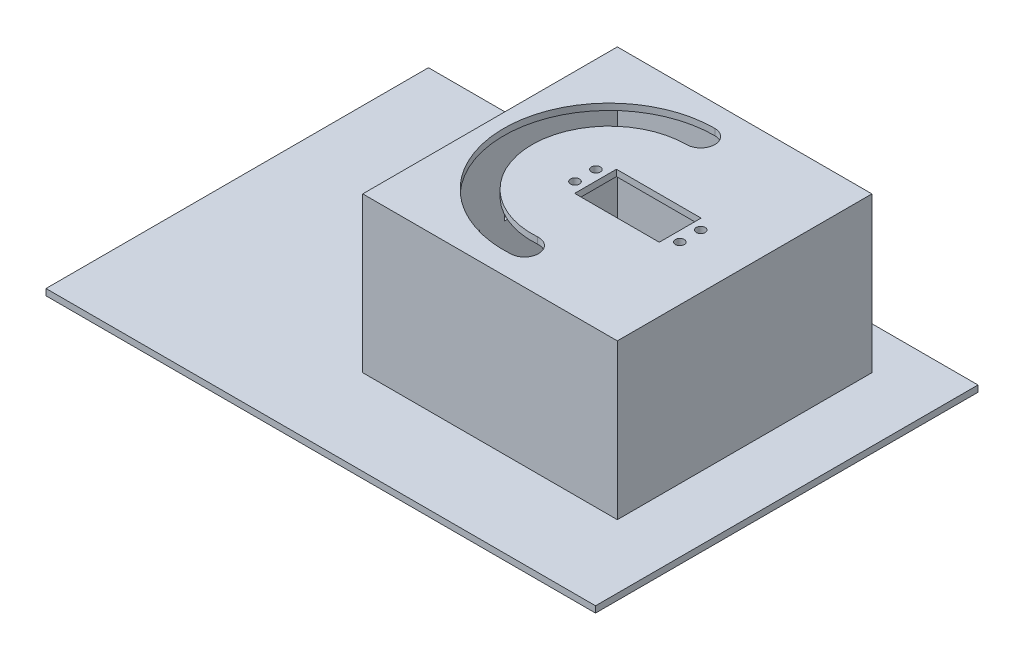
from build123d import *

# Parameters (mm, degrees)
SKETCH1_W           = 140
SKETCH1_H           = 160
BOSS_EXTRUDE1_DEPTH = 3
SKETCH2_W           = 120
SKETCH2_H           = 120
SKETCH2_W_2         = 117
SKETCH2_H_2         = 117
BOSS_EXTRUDE2_DEPTH = 70
SKETCH4_W           = 120
SKETCH4_H           = 120
BOSS_EXTRUDE4_DEPTH = 3
SKETCH5_R           = 2.1
SKETCH5_W           = 39.9
SKETCH5_H           = 19.71
CUT_EXTRUDE2_DEPTH  = 3
SKETCH6_W           = 18.298163042
SKETCH6_H           = 17.309993256
CUT_EXTRUDE3_DEPTH  = 3
CUT_EXTRUDE8_DEPTH  = 5
SKETCH15_W          = 259.021634325
SKETCH15_H          = 180.269434884
BOSS_EXTRUDE5_DEPTH = 3
SKETCH18_R          = 1.6
CUT_EXTRUDE9_DEPTH  = 10
SKETCH19_W          = 12
SKETCH19_H          = 4.5
SKETCH19_H_2        = 8.4
SKETCH19_W_2        = 10.084057066
SKETCH19_H_3        = 7.362028533
CUT_EXTRUDE11_DEPTH = 5


with BuildPart() as part:
    # Sketch1 → Boss-Extrude1 (new body)
    with BuildSketch(Plane(origin=(0, 0, 0), x_dir=(1, 0, 0), z_dir=(0, 1, 0))):
        Rectangle(SKETCH1_W, SKETCH1_H)
    extrude(amount=BOSS_EXTRUDE1_DEPTH)

    # Sketch2 → Boss-Extrude2 (add)
    with BuildSketch(Plane(origin=(0, 3, 0), x_dir=(1, 0, 0), z_dir=(0, 1, 0))):
        Rectangle(SKETCH2_W, SKETCH2_H)
        Rectangle(SKETCH2_W_2, SKETCH2_H_2, mode=Mode.SUBTRACT)
    extrude(amount=BOSS_EXTRUDE2_DEPTH)

    # Sketch4 → Boss-Extrude4 (add)
    with BuildSketch(Plane(origin=(0, 73, 0), x_dir=(1, 0, 0), z_dir=(0, 1, 0))):
        Rectangle(SKETCH4_W, SKETCH4_H)
    extrude(amount=BOSS_EXTRUDE4_DEPTH)

    # Sketch5 → Cut-Extrude2 (cut)
    with BuildSketch(Plane(origin=(0, 76, 0), x_dir=(1, 0, 0), z_dir=(0, 1, 0))):
        with Locations(Location((34.39, -4.925, 0), (0, 0, 270))):
            Circle(SKETCH5_R)
        with Locations(Location((34.39, 4.925, 0), (0, 0, 270))):
            Circle(SKETCH5_R)
        with Locations(Location((-15.03, -4.925, 0), (0, 0, 270))):
            Circle(SKETCH5_R)
        with Locations(Location((-15.03, 4.925, 0), (0, 0, 270))):
            Circle(SKETCH5_R)
        with Locations((9.68, 0)):
            Rectangle(SKETCH5_W, SKETCH5_H)
    extrude(amount=-CUT_EXTRUDE2_DEPTH, mode=Mode.SUBTRACT)

    # Sketch6 → Cut-Extrude3 (cut)
    with BuildSketch(Plane(origin=(0, 76, 0), x_dir=(1, 0, 0), z_dir=(0, 1, 0))):
        Rectangle(SKETCH6_W, SKETCH6_H)
    extrude(amount=-CUT_EXTRUDE3_DEPTH, mode=Mode.SUBTRACT)

    # Sketch13 → Cut-Extrude8 (cut)
    with BuildSketch(Plane(origin=(0, 76, 0), x_dir=(1, 0, 0), z_dir=(0, 1, 0))):
        with BuildLine():
            ThreePointArc((-3.792582359, 49.728765052), (-53.491503795, -1.722579942), (-0.349490011, -49.609426409))
            ThreePointArc((-0.349490011, -49.609426409), (5.82592347, -42.51288634), (-1.270616599, -36.337472859))
            ThreePointArc((-1.270616599, -36.337472859), (-40.195607742, -1.261740085), (-3.792582359, 36.42488497))
            ThreePointArc((-3.792582359, 36.42488497), (2.859357682, 43.076825011), (-3.792582359, 49.728765052))
        make_face()
    extrude(amount=-CUT_EXTRUDE8_DEPTH, mode=Mode.SUBTRACT)

    # Sketch15 → Boss-Extrude5 (add)
    with BuildSketch(Plane(origin=(0, 3, 0), x_dir=(1, 0, 0), z_dir=(0, 1, 0))):
        with Locations((-39.510817163, -10.134717442)):
            Rectangle(SKETCH15_W, SKETCH15_H)
    extrude(amount=-BOSS_EXTRUDE5_DEPTH)

    # Sketch18 → Cut-Extrude9 (cut)
    with BuildSketch(Plane(origin=(0, 3, 0), x_dir=(1, 0, 0), z_dir=(0, 1, 0))):
        with Locations(Location((-55.452, -27.227420358, 0), (0, 0, 270))):
            Circle(SKETCH18_R)
        with Locations(Location((-55.452, 32.208579642, 0), (0, 0, 270))):
            Circle(SKETCH18_R)
        with Locations(Location((4.746, 32.208579642, 0), (0, 0, 270))):
            Circle(SKETCH18_R)
        with Locations(Location((4.746, -27.227420358, 0), (0, 0, 270))):
            Circle(SKETCH18_R)
    extrude(amount=-CUT_EXTRUDE9_DEPTH, mode=Mode.SUBTRACT)

    # Sketch19 → Cut-Extrude11 (cut)
    with BuildSketch(Plane.ZY.offset(60)):
        with Locations((12.367420358, 33)):
            Rectangle(SKETCH19_W, SKETCH19_H)
        with Locations((-11.259414931, 37.2)):
            Rectangle(SKETCH19_W, SKETCH19_H_2)
        with Locations((-28.606781654, 36.742945388)):
            Rectangle(SKETCH19_W_2, SKETCH19_H_3)
    extrude(amount=-CUT_EXTRUDE11_DEPTH, mode=Mode.SUBTRACT)


solid = part.part
